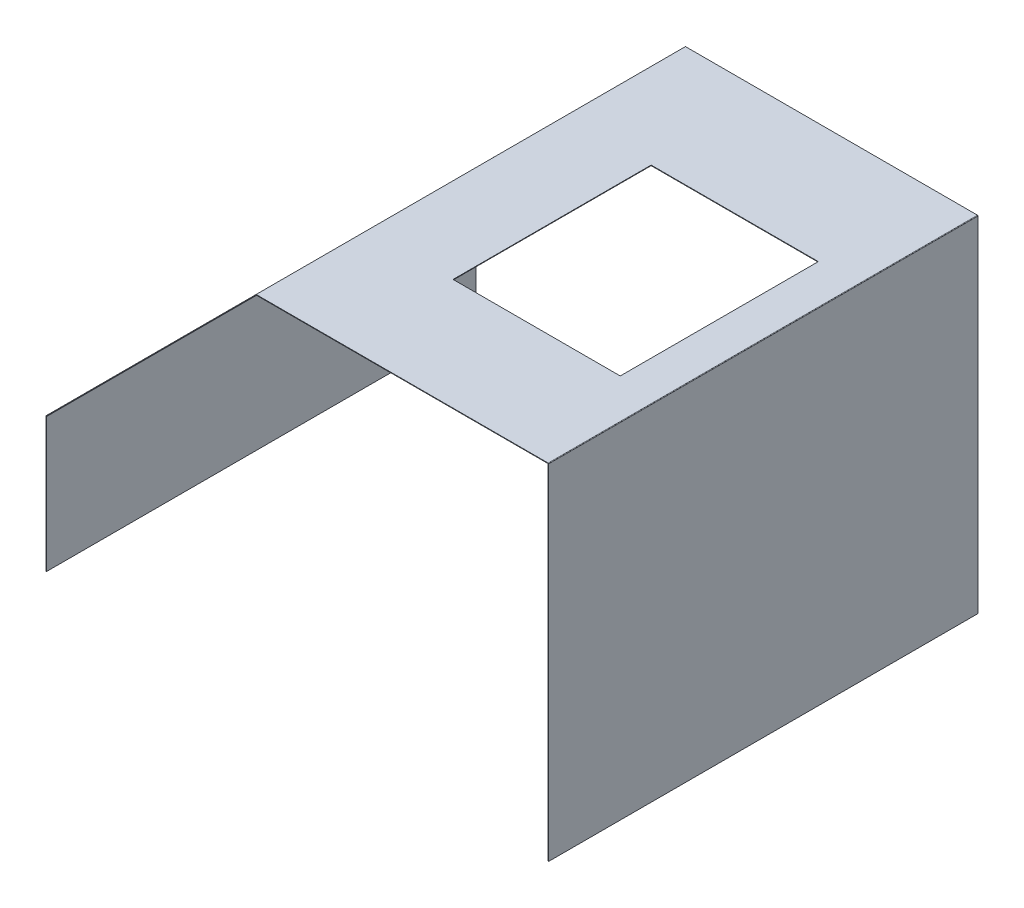
from build123d import *

# Parameters (mm, degrees)
SALIENTE_EXTRUIR1_DEPTH    = 0.83566
SALIENTE_EXTRUIR2_DEPTH    = 12.7
SALIENTE_EXTRUIR3_DEPTH    = 642.126
CROQUIS4_W                 = 255
CROQUIS4_H                 = 0.83566
SALIENTE_EXTRUIR4_DEPTH    = 170
CROQUIS5_W                 = 255
CROQUIS5_H                 = 0.83566
SALIENTE_EXTRUIR5_DEPTH    = 170
CROQUIS6_W                 = 570
CROQUIS6_H                 = 401.24062337
CORTAR_EXTRUIR1_DEPTH      = 190
CORTAR_EXTRUIR2_DEPTH      = 198
CORTAR_EXTRUIR2_DEPTH_BACK = 174
REDONDEO3_R                = 0.8


with BuildPart() as part:
    # Croquis1 → Saliente-Extruir1 (new body)
    with BuildSketch(Plane.XY):
        Polygon((0, 0), (765, 0), (765, 525), (320, 525), (0, 205), align=None)
    extrude(amount=SALIENTE_EXTRUIR1_DEPTH)

    # Croquis7 → Cortar-Extruir2 (cut, two sides: drawn at the far end of the back side and taken through both)
    with BuildSketch(Plane.XY.offset(0.83566).offset(-CORTAR_EXTRUIR2_DEPTH_BACK)):
        Polygon((0, 0), (765, 0), (765, 525), (320, 525), (0, 205), align=None)
    extrude(amount=CORTAR_EXTRUIR2_DEPTH + CORTAR_EXTRUIR2_DEPTH_BACK, mode=Mode.SUBTRACT)


with BuildPart() as body_2:
    # Croquis2 → Saliente-Extruir2 (new body)
    with BuildSketch(Plane.XY.offset(0.83566)):
        Polygon((765.83566, 525.83566), (319.653858294, 525.83566), (-0.83566, 205.346141706), (-0.83566, 0), (0, 0), (0, 205), (320, 525), (765, 525), (765, 0), (765.83566, 0), align=None)
    extrude(amount=SALIENTE_EXTRUIR2_DEPTH)

    # Croquis3 → Saliente-Extruir3 (add)
    with BuildSketch(Plane.XY.offset(13.53566)):
        Polygon((450, 525.83566), (450, 525), (320, 525), (0, 205), (0, 0), (-0.83566, 0), (-0.83566, 205.346141706), (319.653858294, 525.83566), align=None)
        Polygon((765.83566, 0), (765.83566, 525.83566), (705, 525.83566), (705, 525), (765, 525), (765, 0), align=None)
    extrude(amount=SALIENTE_EXTRUIR3_DEPTH)

    # Croquis4 → Saliente-Extruir4 (add)
    with BuildSketch(Plane.XY.offset(13.53566)):
        with Locations((577.5, 525.41783)):
            Rectangle(CROQUIS4_W, CROQUIS4_H)
    extrude(amount=SALIENTE_EXTRUIR4_DEPTH)

    # Croquis5 → Saliente-Extruir5 (add)
    with BuildSketch(Plane.XY.offset(655.66166)):
        with Locations((577.5, 525.41783)):
            Rectangle(CROQUIS5_W, CROQUIS5_H)
    extrude(amount=-SALIENTE_EXTRUIR5_DEPTH)

    # Croquis6 → Cortar-Extruir1 (cut)
    with BuildSketch(Plane(origin=(-103.090900853, 103.090900853, 0), x_dir=(0, 0, 1), z_dir=(-0.7071067811865477, 0.7071067811865475, 0))):
        with Locations((328.24866, 397.231060123)):
            Rectangle(CROQUIS6_W, CROQUIS6_H)
    extrude(amount=-CORTAR_EXTRUIR1_DEPTH, mode=Mode.SUBTRACT)

    # Redondeo3
    redondeo3_edges = [body_2.edges().sort_by_distance(p)[0] for p in [
        (0, 205, 328.24866),
        (-0.83566, 205.346141706, 328.24866),
        (765.83566, 525.83566, 328.24866),
        (765, 525, 328.24866),
    ]]
    fillet(redondeo3_edges, radius=REDONDEO3_R)


solid = body_2.part
